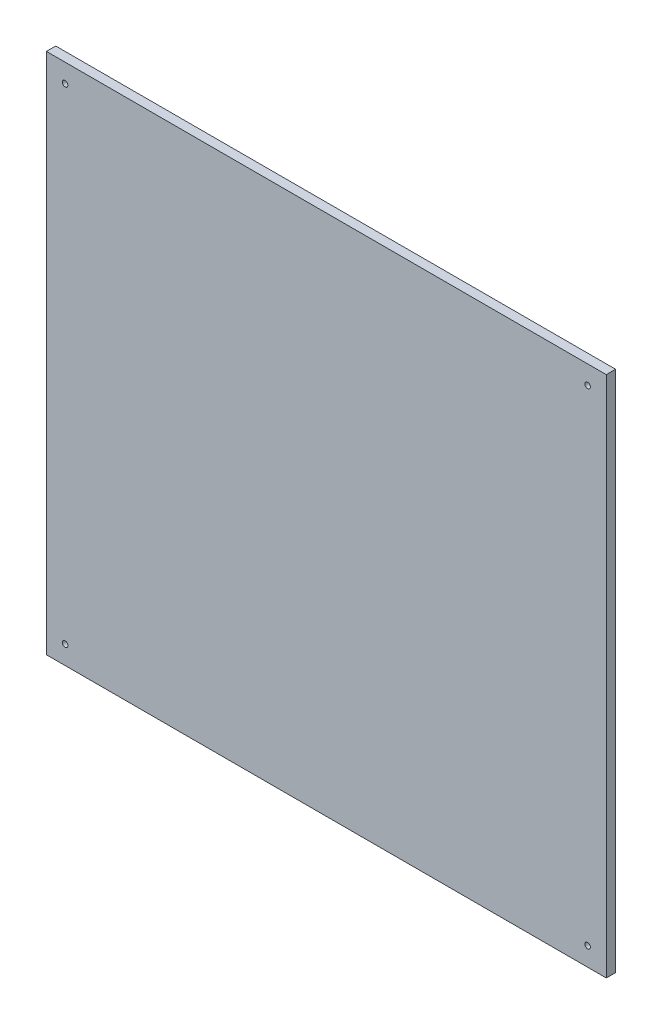
from build123d import *

# Parameters (mm, degrees)
ESQUISSE1_W             = 300
ESQUISSE1_H             = 280
BOSS_EXTRU_1_DEPTH      = 5
ESQUISSE2_R             = 1.5
ENL_V_MAT_EXTRU_1_DEPTH = 411.396150079


with BuildPart() as part:
    # Esquisse1 → Boss.-Extru.1 (new body)
    with BuildSketch(Plane.XY):
        with Locations((150, 140)):
            Rectangle(ESQUISSE1_W, ESQUISSE1_H)
    extrude(amount=BOSS_EXTRU_1_DEPTH)

    # Esquisse2 → Enlèv. mat.-Extru.1 (cut, through all)
    with BuildSketch(Plane.XY):
        with Locations((10, 270)):
            Circle(ESQUISSE2_R)
        with Locations((290, 270)):
            Circle(ESQUISSE2_R)
        with Locations((290, 10)):
            Circle(ESQUISSE2_R)
        with Locations((10, 10)):
            Circle(ESQUISSE2_R)
    extrude(amount=ENL_V_MAT_EXTRU_1_DEPTH, mode=Mode.SUBTRACT)


solid = part.part
